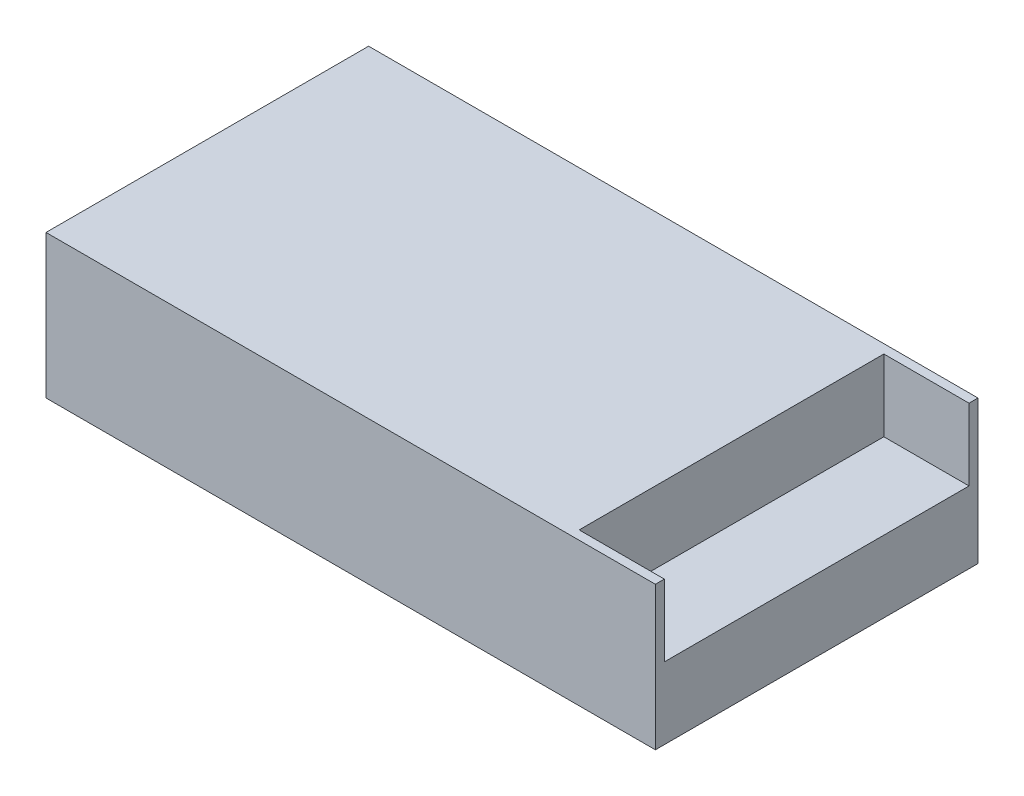
from build123d import *

# Parameters (mm, degrees)
SKETCH1_W           = 215.9
SKETCH1_H           = 114.3
BOSS_EXTRUDE1_DEPTH = 50.8
SKETCH2_W           = 30.181071633
SKETCH2_H           = 107.95
CUT_EXTRUDE1_DEPTH  = 25.4


with BuildPart() as part:
    # Sketch1 → Boss-Extrude1 (new body)
    with BuildSketch(Plane(origin=(0, 0, 0), x_dir=(1, 0, 0), z_dir=(0, 1, 0))):
        with Locations((107.95, 57.15)):
            Rectangle(SKETCH1_W, SKETCH1_H)
    extrude(amount=BOSS_EXTRUDE1_DEPTH)

    # Sketch2 → Cut-Extrude1 (cut)
    with BuildSketch(Plane(origin=(0, 50.8, 0), x_dir=(1, 0, 0), z_dir=(0, 1, 0))):
        with Locations((200.809464184, 57.15)):
            Rectangle(SKETCH2_W, SKETCH2_H)
    extrude(amount=-CUT_EXTRUDE1_DEPTH, mode=Mode.SUBTRACT)


solid = part.part
